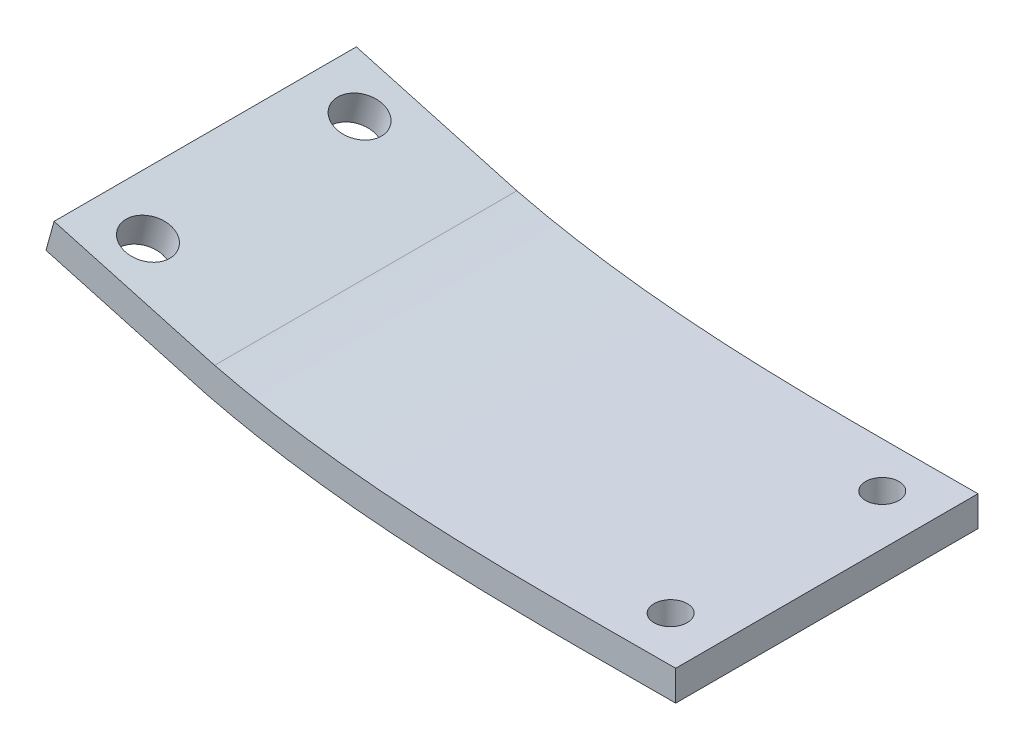
from build123d import *

# Parameters (mm, degrees)
ESTRUSIONE_ESTRUSIONE1_DEPTH = 60
SCHIZZO2_R                   = 3.3
TAGLIO_ESTRUSIONE1_DEPTH     = 163.261772004
SCHIZZO3_R                   = 4.5
TAGLIO_ESTRUSIONE2_DEPTH     = 158.032602074


with BuildPart() as part:
    # Schizzo1 → Estrusione-Estrusione1 (new body)
    with BuildSketch(Plane.XY):
        with BuildLine():
            Line((25.014752149, 15.346258777), (56.954134442, 6.506400743))
            add(Edge.make_bspline(
                [(150, 0), (126.370664176, -0.028998352), (94.908093193, -0.705091299), (64.163963919, 4.724970041), (56.954134442, 6.506400743)],
                knots=[0, 0, 0, 0, 0.761803866, 1, 1, 1, 1], degree=3))
            Line((150, 0), (149.992636696, 5.999995482))
            add(Edge.make_bspline(
                [(58.473520543, 12.311445177), (62.126468599, 11.410871011), (69.480954345, 9.870901955), (84.475289112, 7.646971822), (103.507977373, 6.219278985), (126.666543406, 5.867237142), (142.227417194, 5.990465863), (149.992636696, 5.999995482)],
                knots=[0, 0, 0, 0, 0.124885495, 0.24977099, 0.49954198, 0.74931297, 0.99908396, 0.99908396, 0.99908396, 0.99908396], degree=3))
            Line((58.473520543, 12.311445177), (26.615203686, 21.128866742))
            Line((26.615203686, 21.128866742), (25.014752149, 15.346258777))
        make_face()
    extrude(amount=-ESTRUSIONE_ESTRUSIONE1_DEPTH)

    # Schizzo2 → Taglio-Estrusione1 (cut, through all)
    with BuildSketch(Plane(origin=(0, 6, 0), x_dir=(1, 0, 0), z_dir=(0, 1, 0))):
        with Locations(Location((139.992636696, 51, 0), (0, 0, 270))):
            Circle(SCHIZZO2_R)
        with Locations(Location((139.992636696, 9, 0), (0, 0, 270))):
            Circle(SCHIZZO2_R)
    extrude(amount=-TAGLIO_ESTRUSIONE1_DEPTH, mode=Mode.SUBTRACT)

    # Schizzo3 → Taglio-Estrusione2 (cut, through all)
    with BuildSketch(Plane(origin=(7.325457705, 26.467686836, 0), x_dir=(0.9637679941855859, -0.26674192280834413, 0), z_dir=(0.2667419228083441, 0.9637679941855858, 0))):
        with Locations(Location((30.01492693, 51, 0), (0, 0, 180))):
            Circle(SCHIZZO3_R)
        with Locations(Location((30.01492693, 9, 0), (0, 0, 180))):
            Circle(SCHIZZO3_R)
    extrude(amount=-TAGLIO_ESTRUSIONE2_DEPTH, mode=Mode.SUBTRACT)


solid = part.part
